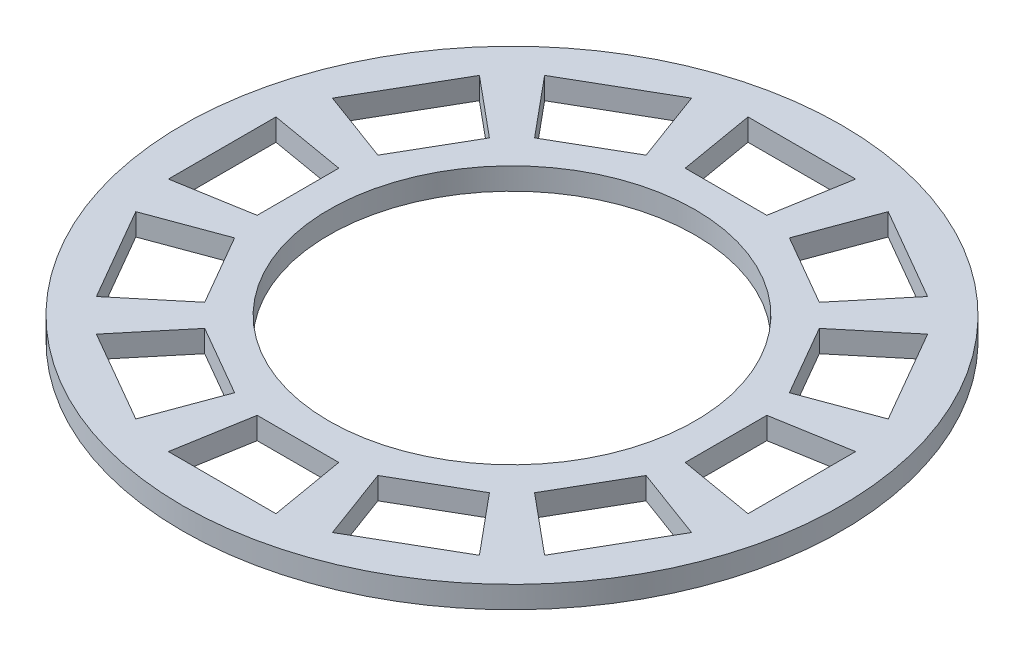
from build123d import *

# Parameters (mm, degrees)
SKETCH1_R           = 45
SKETCH1_R_2         = 25
BOSS_EXTRUDE1_DEPTH = 3


with BuildPart() as part:
    # Sketch1 → Boss-Extrude1 (new body)
    with BuildSketch(Plane(origin=(0, 0, 0), x_dir=(1, 0, 0), z_dir=(0, 1, 0))):
        with Locations(Location((0, 0, 0), (0, 0, 270))):
            Circle(SKETCH1_R)
        with Locations(Location((0, 0, 0), (0, 0, 270))):
            Circle(SKETCH1_R_2, mode=Mode.SUBTRACT)
        Polygon((-7.346, 39.573965988), (7.346, 39.573965988), (5.573, 29.223349757), (-5.573, 29.223349757), align=None, mode=Mode.SUBTRACT)
        Polygon((9.785315303, 28.094663273), (13.425160378, 37.945059874), (26.14880561, 30.599059874), (19.438034454, 22.521663273), align=None, mode=Mode.SUBTRACT)
        Polygon((22.521663273, 19.438034454), (30.599059874, 26.14880561), (37.945059874, 13.425160378), (28.094663273, 9.785315303), align=None, mode=Mode.SUBTRACT)
        Polygon((29.223349757, 5.573), (39.573965988, 7.346), (39.573965988, -7.346), (29.223349757, -5.573), align=None, mode=Mode.SUBTRACT)
        Polygon((28.094663273, -9.785315303), (37.945059874, -13.425160378), (30.599059874, -26.14880561), (22.521663273, -19.438034454), align=None, mode=Mode.SUBTRACT)
        Polygon((19.438034454, -22.521663273), (26.14880561, -30.599059874), (13.425160378, -37.945059874), (9.785315303, -28.094663273), align=None, mode=Mode.SUBTRACT)
        Polygon((5.573, -29.223349757), (7.346, -39.573965988), (-7.346, -39.573965988), (-5.573, -29.223349757), align=None, mode=Mode.SUBTRACT)
        Polygon((-9.785315303, -28.094663273), (-13.425160378, -37.945059874), (-26.14880561, -30.599059874), (-19.438034454, -22.521663273), align=None, mode=Mode.SUBTRACT)
        Polygon((-22.521663273, -19.438034454), (-30.599059874, -26.14880561), (-37.945059874, -13.425160378), (-28.094663273, -9.785315303), align=None, mode=Mode.SUBTRACT)
        Polygon((-29.223349757, -5.573), (-39.573965988, -7.346), (-39.573965988, 7.346), (-29.223349757, 5.573), align=None, mode=Mode.SUBTRACT)
        Polygon((-28.094663273, 9.785315303), (-37.945059874, 13.425160378), (-30.599059874, 26.14880561), (-22.521663273, 19.438034454), align=None, mode=Mode.SUBTRACT)
        Polygon((-19.438034454, 22.521663273), (-26.14880561, 30.599059874), (-13.425160378, 37.945059874), (-9.785315303, 28.094663273), align=None, mode=Mode.SUBTRACT)
    extrude(amount=BOSS_EXTRUDE1_DEPTH)


solid = part.part
